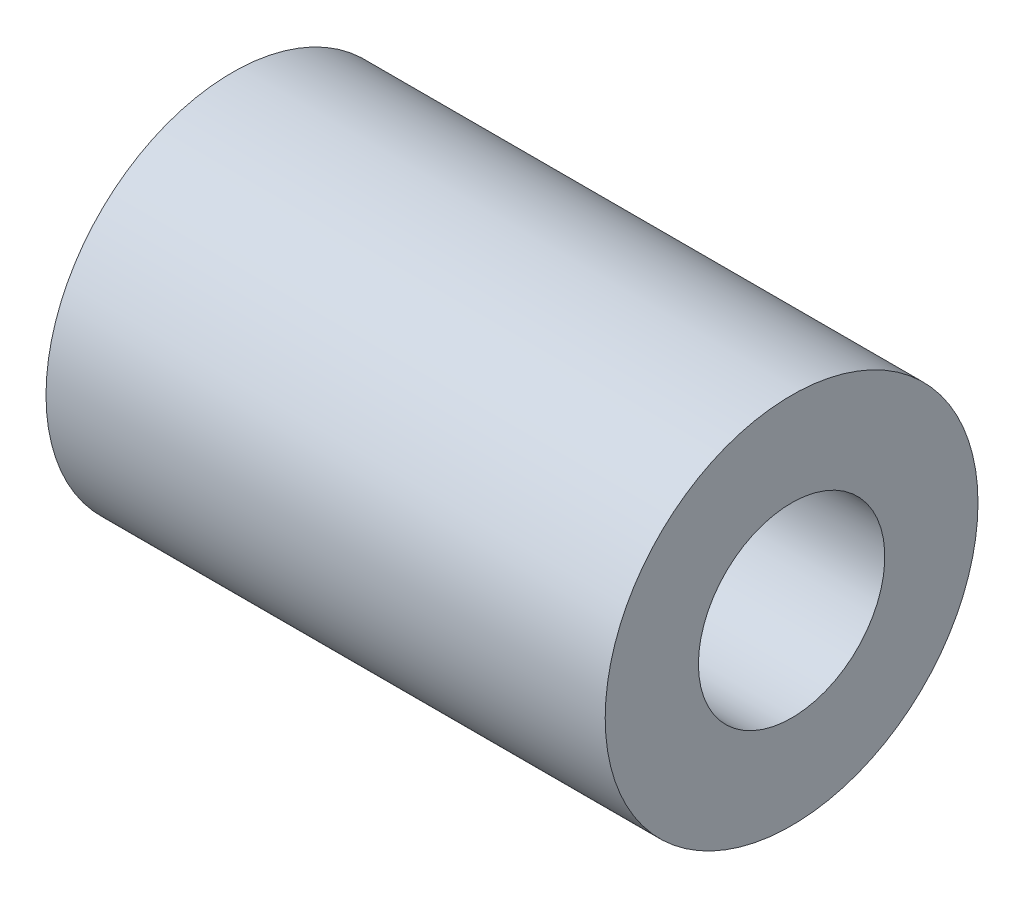
from build123d import *

# Parameters (mm, degrees)
SKETCH1_R      = 3.175
SKETCH1_R_2    = 1.5875
EXTRUDE1_DEPTH = 4.7625


with BuildPart() as part:
    # Sketch1 → Extrude1 (new, symmetric)
    with BuildSketch(Plane(origin=(0, 0, 0), x_dir=(0, 0, -1), z_dir=(1, 0, 0))):
        Circle(SKETCH1_R)
        Circle(SKETCH1_R_2, mode=Mode.SUBTRACT)
    extrude(amount=EXTRUDE1_DEPTH, both=True)


solid = part.part
